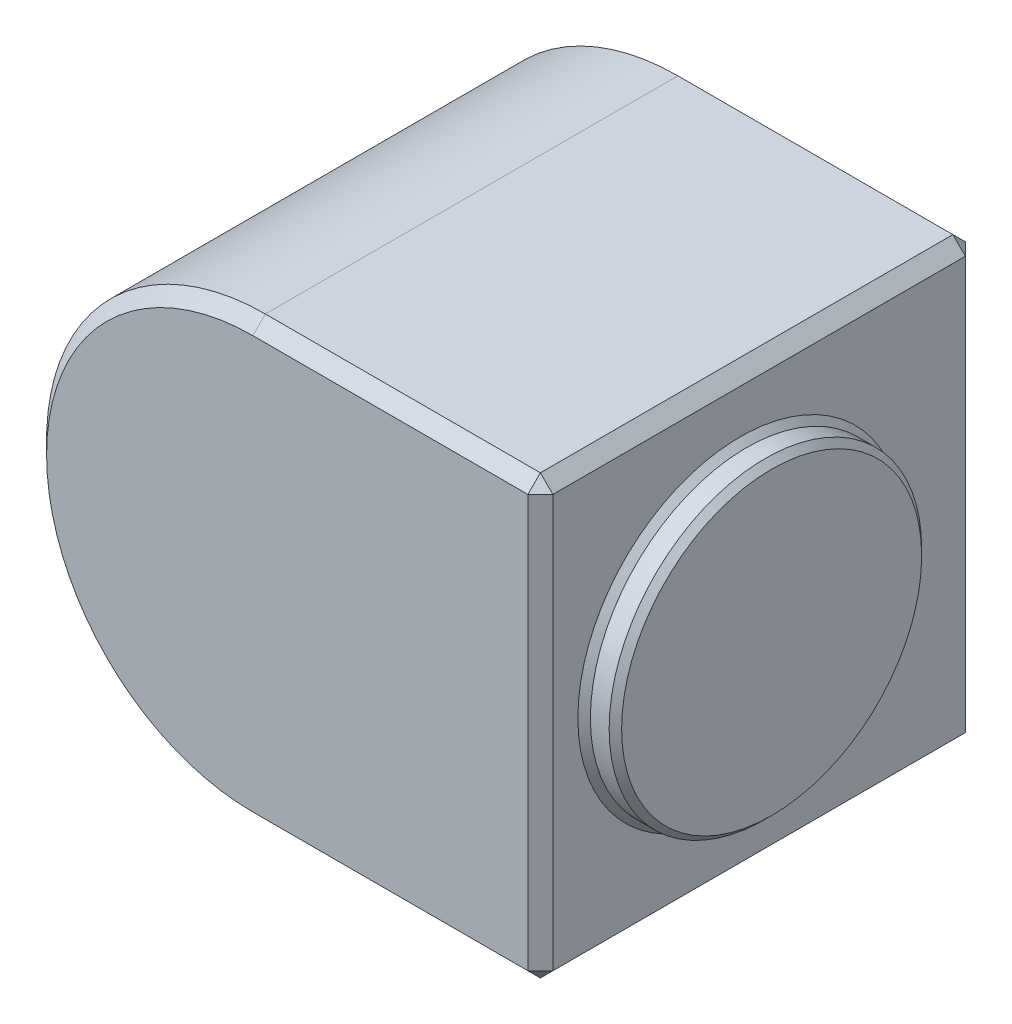
from build123d import *

# Parameters (mm, degrees)
BOSS_EXTRUDE1_DEPTH = 70
SKETCH4_R           = 25
BOSS_EXTRUDE2_DEPTH = 5
CHAMFER1_SIZE       = 2
SKETCH5_R           = 26
CUT_EXTRUDE1_DEPTH  = 5
CHAMFER3_SIZE       = 1


with BuildPart() as part:
    # Sketch3 → Boss-Extrude1 (new body)
    with BuildSketch(Plane.XY):
        with BuildLine():
            Line((0, 35), (46, 35))
            Line((46, 35), (46, -35))
            Line((46, -35), (0, -35))
            ThreePointArc((0, -35), (-35, 0), (0, 35))
        make_face()
    extrude(amount=BOSS_EXTRUDE1_DEPTH)

    # Sketch4 → Boss-Extrude2 (add)
    with BuildSketch(Plane(origin=(46, 0, 0), x_dir=(0, 0, -1), z_dir=(1, 0, 0))):
        with Locations(Location((-38, 0, 0), (0, 0, 180))):
            Circle(SKETCH4_R)
    extrude(amount=BOSS_EXTRUDE2_DEPTH)

    # Chamfer1
    chamfer1_edges = [part.edges().sort_by_distance(p)[0] for p in [
        (46, 0, 70),
        (23, 35, 70),
        (-35, 0, 70),
        (23, 35, 0),
        (46, 0, 0),
        (23, -35, 0),
        (-35, 0, 0),
        (23, -35, 70),
        (46, 35, 35),
        (46, -35, 35),
    ]]
    chamfer(chamfer1_edges, length=CHAMFER1_SIZE)

    # Sketch5 → Cut-Extrude1 (cut)
    with BuildSketch(Plane(origin=(0, 0, 0), x_dir=(-1, 0, 0), z_dir=(0, 0, -1))):
        Circle(SKETCH5_R)
    extrude(amount=-CUT_EXTRUDE1_DEPTH, mode=Mode.SUBTRACT)

    # Chamfer3
    chamfer3_edges = [part.edges().sort_by_distance(p)[0] for p in [
        (46, 0, 13),
        (51, 0, 13),
        (26, 0, 5),
        (26, 0, 0),
    ]]
    chamfer(chamfer3_edges, length=CHAMFER3_SIZE)


solid = part.part
